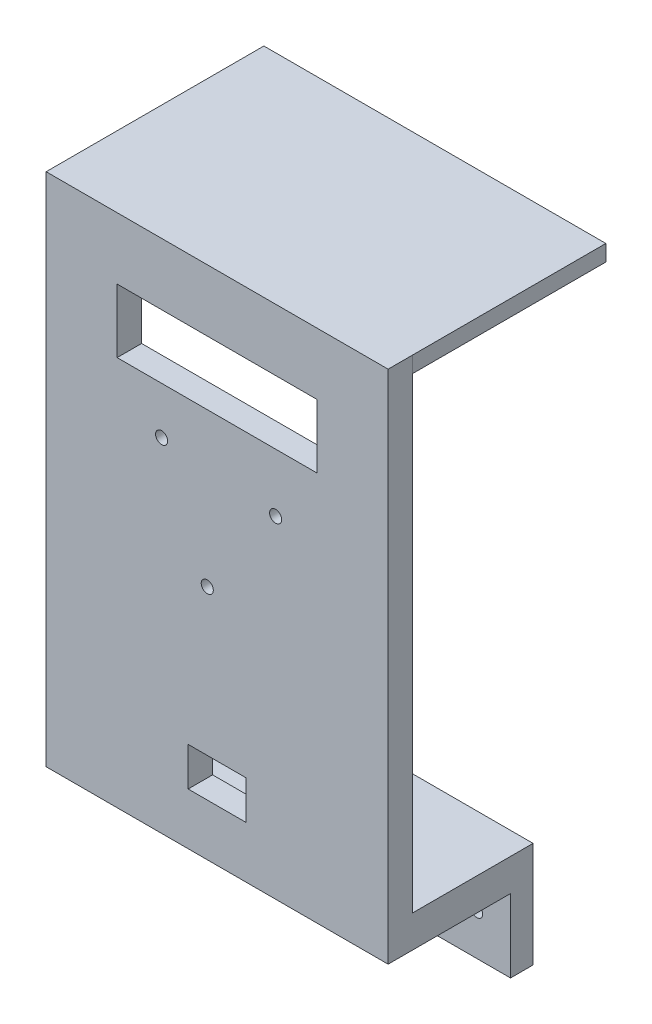
from build123d import *

# Parameters (mm, degrees)
SKETCH_1_W          = 106.172
SKETCH_1_H          = 32.7
SKETCH_1_R          = 1.778
EXTRUDE_1_DEPTH     = 15
SKETCH_2_W          = 106.172
SKETCH_2_H          = 32.7
SKETCH_2_R          = 1.778
EXTRUDE_2_DEPTH     = 30
EXTRUDE_3_DEPTH     = 106
SKETCH_8_W          = 106.172
SKETCH_8_H          = 7.597957824
EXTRUDE_5_DEPTH     = 140
CUT_EXTRUDE_1_DEPTH = 146
SKETCH_11_W         = 106.172
SKETCH_11_H         = 7.597957824
EXTRUDE_7_DEPTH     = 10
SKETCH_15_W         = 106.17086593
SKETCH_15_H         = 5
EXTRUDE_11_DEPTH    = 60
SKETCH_16_W         = 18
SKETCH_16_H         = 12
CUT_EXTRUDE_2_DEPTH = 7.8
SKETCH_18_R         = 1.875
CUT_EXTRUDE_3_DEPTH = 10
SKETCH_20_W         = 106.172
SKETCH_20_H         = 22.709616495
CUT_EXTRUDE_4_DEPTH = 33
SKETCH_21_W         = 106.172
SKETCH_21_H         = 22.709616495
CUT_EXTRUDE_5_DEPTH = 5
SKETCH_30_W         = 62.094803524
SKETCH_30_H         = 19.778637262
CUT_EXTRUDE_6_DEPTH = 10


with BuildPart() as part:
    # 스케치1 → 보스-돌출1 (new body)
    with BuildSketch(Plane.XY):
        with Locations((3.3528, 15.362172506)):
            Rectangle(SKETCH_1_W, SKETCH_1_H)
        with Locations((46.0248, 11.812172506)):
            Circle(SKETCH_1_R, mode=Mode.SUBTRACT)
        with Locations((34.8488, 11.812172506)):
            Circle(SKETCH_1_R, mode=Mode.SUBTRACT)
        with Locations((-38.7332, 12.012172506)):
            Circle(SKETCH_1_R, mode=Mode.SUBTRACT)
        with Locations((-27.5332, 12.012172506)):
            Circle(SKETCH_1_R, mode=Mode.SUBTRACT)
    extrude(amount=EXTRUDE_1_DEPTH)

    # 스케치2 → 보스-돌출2 (add)
    with BuildSketch(Plane.XY.offset(15)):
        with Locations((3.3528, 15.362172506)):
            Rectangle(SKETCH_2_W, SKETCH_2_H)
        with Locations((-38.7332, 12.012172506)):
            Circle(SKETCH_2_R, mode=Mode.SUBTRACT)
        with Locations((-27.5332, 12.012172506)):
            Circle(SKETCH_2_R, mode=Mode.SUBTRACT)
        with Locations((34.8488, 11.812172506)):
            Circle(SKETCH_2_R, mode=Mode.SUBTRACT)
        with Locations((46.0248, 11.812172506)):
            Circle(SKETCH_2_R, mode=Mode.SUBTRACT)
    extrude(amount=EXTRUDE_2_DEPTH)

    # 스케치4 → 보스-돌출3 (add)
    with BuildSketch(Plane.ZY.offset(49.7332)):
        Polygon((45, -0.987827494), (25.502768184, 31.712172506), (45, 31.712172506), align=None)
    extrude(amount=-EXTRUDE_3_DEPTH)

    # 스케치8 → 보스-돌출5 (add)
    with BuildSketch(Plane(origin=(0, 31.712172506, 0), x_dir=(1, 0, 0), z_dir=(0, 1, 0))):
        with Locations((3.3528, -41.201021088)):
            Rectangle(SKETCH_8_W, SKETCH_8_H)
    extrude(amount=EXTRUDE_5_DEPTH)

    # 스케치9 → 컷-돌출1 (cut)
    with BuildSketch(Plane.ZY.offset(49.7332)):
        Polygon((45, -0.987827494), (17.051243473, -0.987827494), (45, 21.721789001), align=None)
    extrude(amount=-CUT_EXTRUDE_1_DEPTH, mode=Mode.SUBTRACT)

    # 스케치11 → 보스-돌출7 (add)
    with BuildSketch(Plane(origin=(0, 171.712172506, 0), x_dir=(1, 0, 0), z_dir=(0, 1, 0))):
        with Locations((3.3528, -41.201021088)):
            Rectangle(SKETCH_11_W, SKETCH_11_H)
    extrude(amount=EXTRUDE_7_DEPTH)

    # 스케치15 → 보스-돌출11 (add)
    with BuildSketch(Plane(origin=(0, 0, 37.402042176), x_dir=(-1, 0, 0), z_dir=(0, 0, -1))):
        with Locations((-3.352232965, 179.212172506)):
            Rectangle(SKETCH_15_W, SKETCH_15_H)
    extrude(amount=EXTRUDE_11_DEPTH)

    # 스케치16 → 컷-돌출2 (cut)
    with BuildSketch(Plane.XY.offset(45)):
        with Locations((3.3528, 43.784089849)):
            Rectangle(SKETCH_16_W, SKETCH_16_H)
    extrude(amount=-CUT_EXTRUDE_2_DEPTH, mode=Mode.SUBTRACT)

    # 스케치18 → 컷-돌출3 (cut)
    with BuildSketch(Plane.XY.offset(45)):
        with Locations((-13.882118572, 128.141421182)):
            Circle(SKETCH_18_R)
        with Locations((21.515537396, 124.701234261)):
            Circle(SKETCH_18_R)
        with Locations((0.28811198, 95.127423383)):
            Circle(SKETCH_18_R)
    extrude(amount=-CUT_EXTRUDE_3_DEPTH, mode=Mode.SUBTRACT)

    # 스케치20 → 컷-돌출4 (cut)
    with BuildSketch(Plane.XY.offset(45)):
        with Locations((3.3528, 10.366980754)):
            Rectangle(SKETCH_20_W, SKETCH_20_H)
    extrude(amount=-CUT_EXTRUDE_4_DEPTH, mode=Mode.SUBTRACT)

    # 스케치21 → 컷-돌출5 (cut)
    with BuildSketch(Plane.XY.offset(12)):
        with Locations((3.3528, 10.366980754)):
            Rectangle(SKETCH_21_W, SKETCH_21_H)
    extrude(amount=-CUT_EXTRUDE_5_DEPTH, mode=Mode.SUBTRACT)

    # 스케치30 → 컷-돌출6 (cut)
    with BuildSketch(Plane.XY.offset(45)):
        with Locations((3.3528, 152.636415487)):
            Rectangle(SKETCH_30_W, SKETCH_30_H)
    extrude(amount=-CUT_EXTRUDE_6_DEPTH, mode=Mode.SUBTRACT)


solid = part.part
